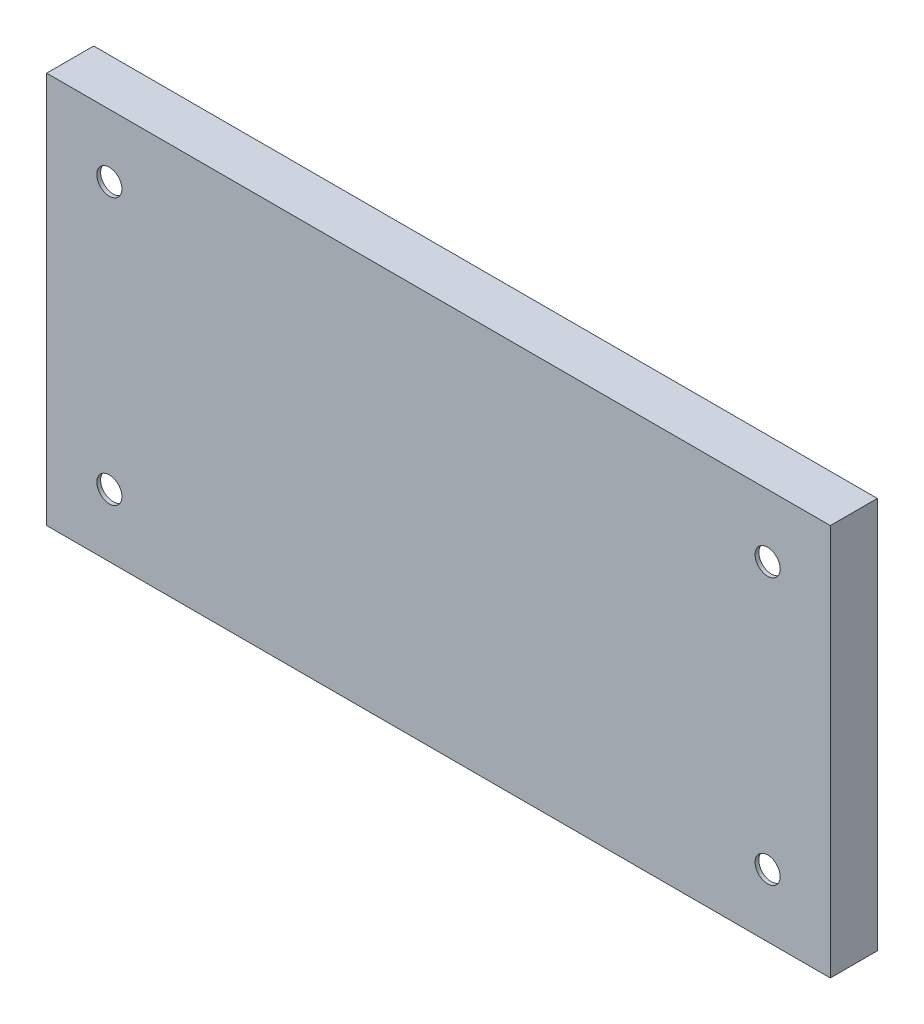
from build123d import *

# Parameters (mm, degrees)
SKETCH_1_W          = 250
SKETCH_1_H          = 125
EXTRUDE_1_DEPTH     = 15
SHELL_1_T           = -1.2
SKETCH_2_R          = 4
CUT_EXTRUDE_1_DEPTH = 15


with BuildPart() as part:
    # 草图1 → 凸台-拉伸1 (new body)
    with BuildSketch(Plane.XY):
        Rectangle(SKETCH_1_W, SKETCH_1_H)
    extrude(amount=EXTRUDE_1_DEPTH)

    # 抽壳1
    shell_1_openings = [part.faces().sort_by_distance(p)[0] for p in [
        (0, 0, 0),
    ]]
    offset(amount=SHELL_1_T, openings=shell_1_openings, kind=Kind.INTERSECTION)

    # 草图2 → 切除-拉伸1 (cut)
    with BuildSketch(Plane.XY.offset(15)):
        with Locations((-105, 42.5)):
            Circle(SKETCH_2_R)
        with Locations((105, 42.5)):
            Circle(SKETCH_2_R)
        with Locations((105, -42.5)):
            Circle(SKETCH_2_R)
        with Locations((-105, -42.5)):
            Circle(SKETCH_2_R)
    extrude(amount=-CUT_EXTRUDE_1_DEPTH, mode=Mode.SUBTRACT)


solid = part.part
